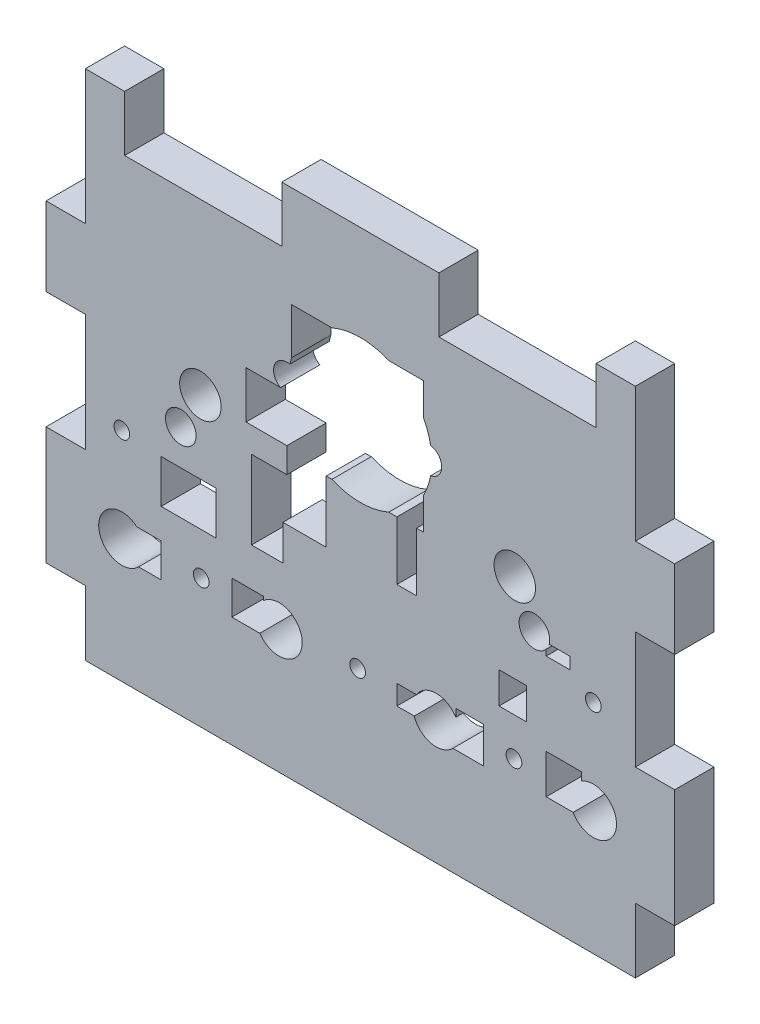
from build123d import *

# Parameters (mm, degrees)
ESQUISSE1_W        = 70
ESQUISSE1_H        = 58.15
ESQUISSE1_R        = 1.95
ESQUISSE1_R_2      = 1
ESQUISSE1_R_3      = 2.640146182
ESQUISSE1_W_2      = 7
ESQUISSE1_H_2      = 5.5
ESQUISSE1_W_3      = 3.5
ESQUISSE1_H_3      = 4
BOSS_EXTRU_1_DEPTH = 5
ESQUISSE2_R        = 9.1
CR_NEAUX_DEPTH     = 5
ESQUISSE3_W        = 20
ESQUISSE3_H        = 7.07
ESQUISSE3_W_2      = 5
ESQUISSE3_H_2      = 15
ESQUISSE3_H_3      = 10
CR_NEAUX_2_DEPTH   = 5


with BuildPart() as part:
    # Esquisse1 → Boss.-Extru.1 (new body)
    with BuildSketch(Plane.XY):
        with Locations((35, 29.075)):
            Rectangle(ESQUISSE1_W, ESQUISSE1_H)
        with Locations((12.149282213, 31.8)):
            Circle(ESQUISSE1_R, mode=Mode.SUBTRACT)
        with Locations((4.649282213, 27.7)):
            Circle(ESQUISSE1_R_2, mode=Mode.SUBTRACT)
        with Locations((14.749282213, 16.45)):
            Circle(ESQUISSE1_R_2, mode=Mode.SUBTRACT)
        with Locations((34.649282213, 16.45)):
            Circle(ESQUISSE1_R_2, mode=Mode.SUBTRACT)
        with Locations((54.549282213, 16.45)):
            Circle(ESQUISSE1_R_2, mode=Mode.SUBTRACT)
        with Locations((64.649282213, 27.7)):
            Circle(ESQUISSE1_R_2, mode=Mode.SUBTRACT)
        with Locations((54.654459148, 36.574348259)):
            Circle(ESQUISSE1_R_3, mode=Mode.SUBTRACT)
        with Locations((14.644105278, 36.574348259)):
            Circle(ESQUISSE1_R_3, mode=Mode.SUBTRACT)
        with BuildLine():
            Line((26.249282245, 52.35), (43.049282245, 52.35))
            Line((43.049282245, 52.35), (43.049282245, 45.7))
            Line((43.049282245, 45.7), (43.649282213, 45.7))
            ThreePointArc((43.649282213, 45.7), (45.349282213, 44), (43.649282213, 42.3))
            Line((43.649282213, 42.3), (43.049282218, 42.3))
            Line((43.049282218, 42.3), (43.049282218, 35.65))
            Line((43.049282218, 35.65), (42.149282213, 35.65))
            Line((42.149282213, 35.65), (42.149282213, 28.2))
            Line((42.149282213, 28.2), (39.649282213, 28.2))
            Line((39.649282213, 28.2), (39.649282213, 35.65))
            Line((39.649282213, 35.65), (30.649282213, 35.65))
            Line((30.649282213, 35.65), (30.649282213, 27.8))
            Line((30.649282213, 27.8), (25.149282213, 27.8))
            Line((25.149282213, 27.8), (25.149282213, 23.3))
            Line((25.149282213, 23.3), (21.149282213, 23.3))
            Line((21.149282213, 23.3), (21.149282213, 33.3))
            Line((21.149282213, 33.3), (25.649282213, 33.3))
            Line((25.649282213, 33.3), (25.649282213, 36.5))
            Line((25.649282213, 36.5), (20.449282213, 36.5))
            Line((20.449282213, 36.5), (20.449282213, 42.5))
            Line((20.449282213, 42.5), (24.849282213, 42.5))
            ThreePointArc((24.849282213, 42.5), (24.000039995, 44.412310574), (25.64928225, 45.7))
            Line((25.64928225, 45.7), (26.249282245, 45.7))
            Line((26.249282245, 45.7), (26.249282245, 52.35))
        make_face(mode=Mode.SUBTRACT)
        with Locations((13.149282213, 24.55)):
            Rectangle(ESQUISSE1_W_2, ESQUISSE1_H_2, mode=Mode.SUBTRACT)
        with BuildLine():
            Line((6.557160615, 18), (9.649282213, 18))
            Line((9.649282213, 18), (9.649282213, 13.7))
            Line((9.649282213, 13.7), (6.770602556, 13.7))
            ThreePointArc((6.770602556, 13.7), (1.702909759, 15.603748964), (6.557160615, 18))
        make_face(mode=Mode.SUBTRACT)
        with BuildLine():
            Line((22.649282213, 17.918524844), (22.649282213, 18.4))
            Line((22.649282213, 18.4), (18.649282213, 18.4))
            Line((18.649282213, 18.4), (18.649282213, 14.1))
            Line((18.649282213, 14.1), (22.20387836, 14.1))
            ThreePointArc((22.20387836, 14.1), (27.579416484, 15.40822061), (22.649282213, 17.918524844))
        make_face(mode=Mode.SUBTRACT)
        with BuildLine():
            Line((42.139302133, 17.3), (39.649282213, 17.3))
            Line((39.649282213, 17.3), (39.649282213, 14.8))
            Line((39.649282213, 14.8), (41.856434204, 14.8))
            ThreePointArc((41.856434204, 14.8), (44.004893082, 12.87123939), (46.770602556, 13.7))
            Line((46.770602556, 13.7), (50.649282213, 13.7))
            Line((50.649282213, 13.7), (50.649282213, 18.3))
            Line((50.649282213, 18.3), (47.149282213, 18.3))
            Line((47.149282213, 18.3), (47.149282213, 17.316045976))
            ThreePointArc((47.149282213, 17.316045976), (44.639833994, 18.69998487), (42.139302133, 17.3))
        make_face(mode=Mode.SUBTRACT)
        with Locations((54.399282213, 23.3)):
            Rectangle(ESQUISSE1_W_3, ESQUISSE1_H_3, mode=Mode.SUBTRACT)
        with BuildLine():
            Line((58.649282213, 30.554006421), (58.649282213, 29.8))
            Line((58.649282213, 29.8), (61.649282213, 29.8))
            Line((61.649282213, 29.8), (61.649282213, 31.3))
            Line((61.649282213, 31.3), (59.034089895, 31.3))
            ThreePointArc((59.034089895, 31.3), (55.416262488, 32.69394778), (58.649282213, 30.554006421))
        make_face(mode=Mode.SUBTRACT)
        with BuildLine():
            Line((63.149282213, 19.3), (63.149282213, 18.290177159))
            ThreePointArc((63.149282213, 18.290177159), (67.498784507, 14.986562594), (62.080235697, 14.3))
            Line((62.080235697, 14.3), (58.649282213, 14.3))
            Line((58.649282213, 14.3), (58.649282213, 19.3))
            Line((58.649282213, 19.3), (63.149282213, 19.3))
        make_face(mode=Mode.SUBTRACT)
    extrude(amount=BOSS_EXTRU_1_DEPTH)

    # Esquisse2 → Cr_neaux (cut)
    with BuildSketch(Plane.XY.offset(5)):
        with Locations((35, 44)):
            Circle(ESQUISSE2_R)
    extrude(amount=-CR_NEAUX_DEPTH, mode=Mode.SUBTRACT)

    # Esquisse3 → Cr_neaux 2 (add)
    with BuildSketch(Plane.XY.offset(5)):
        with Locations((35, 61.685)):
            Rectangle(ESQUISSE3_W, ESQUISSE3_H)
        with Locations((2.5, 61.685)):
            Rectangle(ESQUISSE3_W_2, ESQUISSE3_H)
        with Locations((-2.5, 15.75)):
            Rectangle(ESQUISSE3_W_2, ESQUISSE3_H_2)
        with Locations((-2.5, 43.15)):
            Rectangle(ESQUISSE3_W_2, ESQUISSE3_H_3)
        with Locations((72.5, 43.15)):
            Rectangle(ESQUISSE3_W_2, ESQUISSE3_H_3)
        with Locations((72.5, 15.75)):
            Rectangle(ESQUISSE3_W_2, ESQUISSE3_H_2)
        with Locations((67.5, 61.685)):
            Rectangle(ESQUISSE3_W_2, ESQUISSE3_H)
    extrude(amount=-CR_NEAUX_2_DEPTH)


solid = part.part
